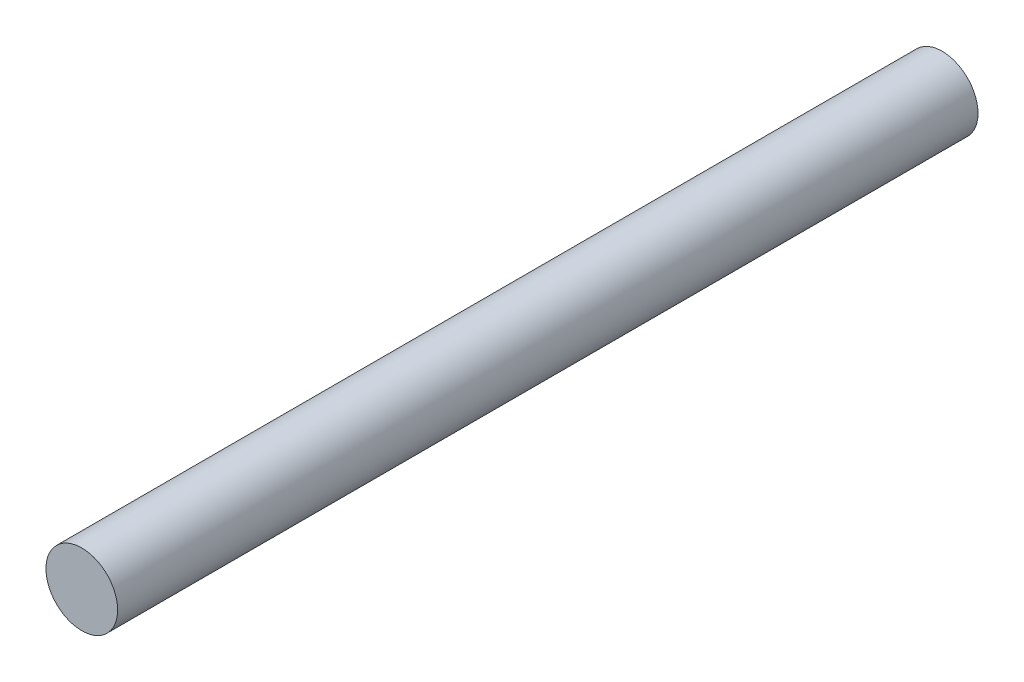
from build123d import *

# Parameters (mm, degrees)
SKETCH1_R           = 2
BOSS_EXTRUDE1_DEPTH = 48


with BuildPart() as part:
    # Sketch1 → Boss-Extrude1 (new body)
    with BuildSketch(Plane.XY):
        Circle(SKETCH1_R)
    extrude(amount=BOSS_EXTRUDE1_DEPTH)


solid = part.part
